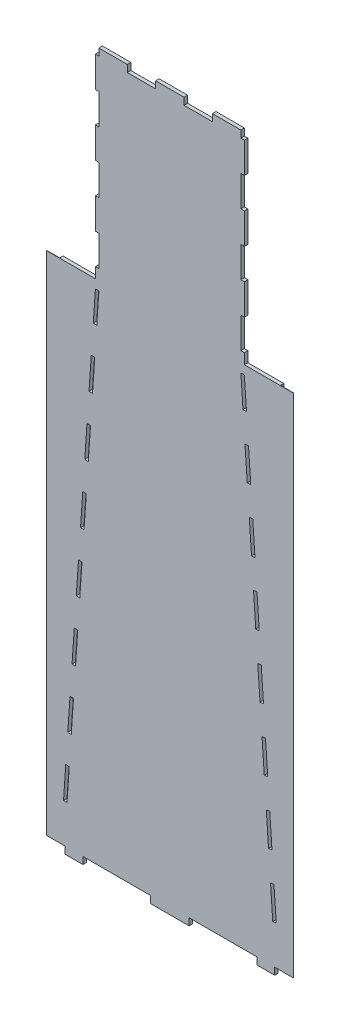
from build123d import *

# Parameters (mm, degrees)
BOSS_EXTRUDE1_DEPTH = 10.16
SKETCH2_W           = 38.1
SKETCH2_H           = 9.5
CUT_EXTRUDE1_DEPTH  = 2540


with BuildPart() as part:
    # Sketch1 → Boss-Extrude1 (new body)
    with BuildSketch(Plane.XY):
        Polygon((-123.444, 2072.64), (-205.715298803, 2072.64), (-205.715298803, 2052.32), (-215.881789204, 2052.32), (-215.881789204, 1963.42), (-205.715298803, 1963.42), (-205.715298803, 1874.52), (-215.881789204, 1874.52), (-215.881789204, 1785.62), (-205.715298803, 1785.62), (-205.715298803, 1696.72), (-215.875298803, 1696.72), (-215.875298803, 1607.82), (-205.715298803, 1607.82), (-205.715298803, 1518.92), (-215.881789204, 1518.92), (-215.881789204, 1488.440000035), (-358.121789204, 1488.440000035), (-358.121789204, 20.32), (-303.52, 20.32), (-303.52, 0), (-252, 0), (-252, 20.32), (-55.8292, 20.32), (-55.8292, 0), (55.8292, 0), (55.8292, 20.32), (252, 20.32), (252, 0), (303.52, 0), (303.52, 20.32), (358.121789204, 20.32), (358.121789204, 1488.440000035), (215.881789204, 1488.440000035), (215.881789204, 1518.92), (205.715298803, 1518.92), (205.715298803, 1607.82), (215.875298803, 1607.82), (215.875298803, 1696.72), (205.715298803, 1696.72), (205.715298803, 1785.62), (215.881789204, 1785.62), (215.881789204, 1874.52), (205.715298803, 1874.52), (205.715298803, 1963.42), (215.881789204, 1963.42), (215.881789204, 2052.32), (205.715298803, 2052.32), (205.715298803, 2072.64), (123.444, 2072.64), (123.444, 2052.32), (41.135649402, 2052.32), (41.135649402, 2072.64), (-41.135649402, 2072.64), (-41.135649402, 2052.32), (-123.444, 2052.32), align=None)
        Polygon((215.881789204, 1463.040000035), (222.040744894, 1374.366931824), (211.92306481, 1373.664189215), (205.715298803, 1463.040000035), align=None, mode=Mode.SUBTRACT)
        Polygon((-205.715298803, 1463.040000035), (-211.92306481, 1373.664189215), (-222.040744894, 1374.366931824), (-215.881789204, 1463.040000035), align=None, mode=Mode.SUBTRACT)
        Polygon((227.836927701, 1290.916856945), (234.358656272, 1197.020795404), (224.240976188, 1196.318052795), (217.719247617, 1290.214114336), align=None, mode=Mode.SUBTRACT)
        Polygon((-308.266124544, 132.94397688), (-301.755453134, 226.680843836), (-291.63777305, 225.978101227), (-298.14844446, 132.241234271), align=None, mode=Mode.SUBTRACT)
        Polygon((-289.435698895, 404.053512688), (-279.318018811, 403.350770078), (-285.830533081, 309.587370692), (-295.948213166, 310.290113301), align=None, mode=Mode.SUBTRACT)
        Polygon((-283.630301787, 487.636249721), (-277.115944656, 581.426181539), (-266.998264572, 580.72343893), (-273.512621703, 486.933507112), align=None, mode=Mode.SUBTRACT)
        Polygon((-264.796190418, 758.798850391), (-254.678510334, 758.096107781), (-261.194710324, 664.279643533), (-271.312390408, 664.982386142), align=None, mode=Mode.SUBTRACT)
        Polygon((-252.476436179, 936.171519242), (-242.358756095, 935.468776633), (-248.876798945, 841.625779953), (-258.99447903, 842.328522563), align=None, mode=Mode.SUBTRACT)
        Polygon((301.755453134, 226.680843836), (308.266124544, 132.94397688), (298.14844446, 132.241234271), (291.63777305, 225.978101227), align=None, mode=Mode.SUBTRACT)
        Polygon((279.318018811, 403.350770078), (289.435698895, 404.053512688), (295.948213166, 310.290113301), (285.830533081, 309.587370692), align=None, mode=Mode.SUBTRACT)
        Polygon((254.678510334, 758.096107781), (264.796190418, 758.798850391), (271.312390408, 664.982386142), (261.194710324, 664.279643533), align=None, mode=Mode.SUBTRACT)
        Polygon((277.115944656, 581.426181539), (283.630301787, 487.636249721), (273.512621703, 486.933507112), (266.998264572, 580.72343893), align=None, mode=Mode.SUBTRACT)
        Polygon((242.358756095, 935.468776633), (252.476436179, 936.171519242), (258.99447903, 842.328522563), (248.876798945, 841.625779953), align=None, mode=Mode.SUBTRACT)
        Polygon((-240.15668194, 1113.544188093), (-230.039001856, 1112.841445484), (-236.558887567, 1018.971916374), (-246.676567651, 1019.674658983), align=None, mode=Mode.SUBTRACT)
        Polygon((-227.836927701, 1290.916856945), (-217.719247617, 1290.214114336), (-224.240976188, 1196.318052795), (-234.358656272, 1197.020795404), align=None, mode=Mode.SUBTRACT)
        Polygon((230.039001856, 1112.841445484), (240.15668194, 1113.544188093), (246.676567651, 1019.674658983), (236.558887567, 1018.971916374), align=None, mode=Mode.SUBTRACT)
    extrude(amount=BOSS_EXTRUDE1_DEPTH)

    # Sketch2 → Cut-Extrude1 (cut)
    with BuildSketch(Plane(origin=(0, 0, 0), x_dir=(1, 0, 0), z_dir=(0, 1, 0))):
        with Locations((339.071789204, -4.75)):
            Rectangle(SKETCH2_W, SKETCH2_H)
        with Locations((-339.071789204, -4.75)):
            Rectangle(SKETCH2_W, SKETCH2_H)
    extrude(amount=CUT_EXTRUDE1_DEPTH, mode=Mode.SUBTRACT)


solid = part.part
